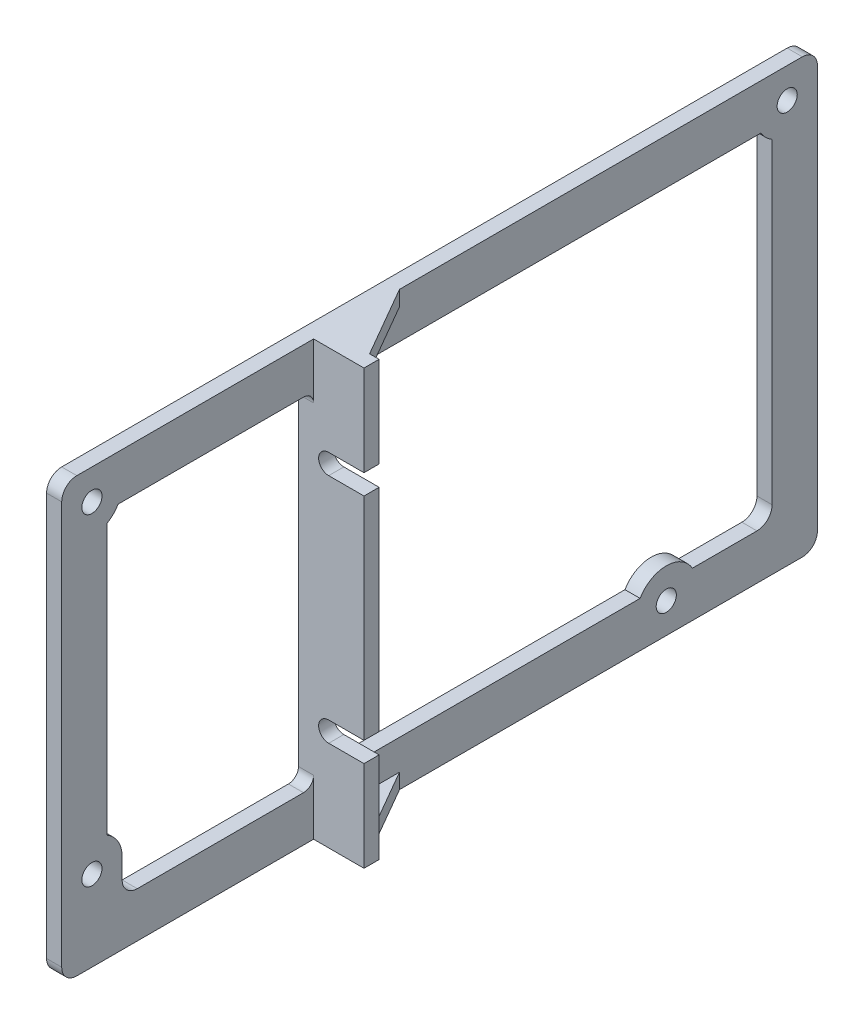
from build123d import *

# Parameters (mm, degrees)
SKETCH_1_R      = 2
EXTRUDE_1_DEPTH = 3
EXTRUDE_2_DEPTH = 3
RIB_6_REACH     = 175.393
SKETCH_4_WALL_W = 365.010042788
SKETCH_4_WALL_H = 3
RIB_7_REACH     = 175.393
SKETCH_5_WALL_W = 365.010042788
SKETCH_5_WALL_H = 3
FILLET_1_R      = 2


with BuildPart() as part:
    # Эскиз1 → Бобышка-Вытянуть1 (new body)
    with BuildSketch(Plane(origin=(0, 0, 0), x_dir=(0, 0, -1), z_dir=(1, 0, 0))):
        with BuildLine():
            Line((0, 3), (0, 83))
            ThreePointArc((0, 83), (0.878679656, 85.121320344), (3, 86))
            Line((3, 86), (147, 86))
            ThreePointArc((147, 86), (149.121320344, 85.121320344), (150, 83))
            Line((150, 83), (150, 3))
            ThreePointArc((150, 3), (149.121320344, 0.878679656), (147, 0))
            Line((147, 0), (3, 0))
            ThreePointArc((3, 0), (0.878679656, 0.878679656), (0, 3))
        make_face()
        with Locations((6, 80)):
            Circle(SKETCH_1_R, mode=Mode.SUBTRACT)
        with Locations((144, 80)):
            Circle(SKETCH_1_R, mode=Mode.SUBTRACT)
        with Locations((120, 6)):
            Circle(SKETCH_1_R, mode=Mode.SUBTRACT)
        with Locations((6, 16)):
            Circle(SKETCH_1_R, mode=Mode.SUBTRACT)
        with BuildLine():
            Line((9, 74.803847577), (9, 21.196152423))
            ThreePointArc((9, 21.196152423), (11.196152423, 19), (12, 16))
            Line((12, 16), (12, 12))
            ThreePointArc((12, 12), (12.878679656, 9.878679656), (15, 9))
            Line((15, 9), (114.803847577, 9))
            ThreePointArc((114.803847577, 9), (120, 12), (125.196152423, 9))
            Line((125.196152423, 9), (138, 9))
            ThreePointArc((138, 9), (140.121320344, 9.878679656), (141, 12))
            Line((141, 12), (141, 74.803847577))
            ThreePointArc((141, 74.803847577), (139.757359313, 75.757359313), (138.803847577, 77))
            Line((138.803847577, 77), (11.196152423, 77))
            ThreePointArc((11.196152423, 77), (10.242640687, 75.757359313), (9, 74.803847577))
        make_face(mode=Mode.SUBTRACT)
    extrude(amount=EXTRUDE_1_DEPTH)

    # Эскиз2 → Бобышка-Вытянуть2 (add)
    with BuildSketch(Plane(origin=(0, 0, -50), x_dir=(-1, 0, 0), z_dir=(0, 0, -1))):
        with BuildLine():
            Line((0, 86), (-13, 86))
            Line((-13, 86), (-13, 68))
            Line((-13, 68), (-6, 68))
            ThreePointArc((-6, 68), (-4, 66), (-6, 64))
            Line((-6, 64), (-13, 64))
            Line((-13, 64), (-13, 22))
            Line((-13, 22), (-6, 22))
            ThreePointArc((-6, 22), (-4, 20), (-6, 18))
            Line((-6, 18), (-13, 18))
            Line((-13, 18), (-13, 0))
            Line((-13, 0), (0, 0))
            Line((0, 0), (0, 86))
        make_face()
    extrude(amount=EXTRUDE_2_DEPTH)

    # Эскиз4 wall → Ребро6 (add, up to next)
    with BuildSketch(Plane(origin=(7.056201664, 86, -60.025547367), x_dir=(-0.499999999996, 0, -0.866025403787), z_dir=(-0.866025403787, 0, 0.499999999996)), mode=Mode.PRIVATE) as rib_6_sk1:
        with Locations((0, 1.5)):
            Rectangle(SKETCH_4_WALL_W, SKETCH_4_WALL_H)
    rib_6_tool1 = extrude(rib_6_sk1.sketch, amount=RIB_6_REACH, mode=Mode.PRIVATE) - part.part
    add(rib_6_tool1.solids().sort_by_distance((7.056201664, 86, -60.025547367))[0])

    # Эскиз5 wall → Ребро7 (add, up to next)
    with BuildSketch(Plane(origin=(7.056201664, 0, -60.025547367), x_dir=(-0.499999999996, 0, -0.866025403787), z_dir=(0.866025403787, 0, -0.499999999996)), mode=Mode.PRIVATE) as rib_7_sk1:
        with Locations((0, 1.5)):
            Rectangle(SKETCH_5_WALL_W, SKETCH_5_WALL_H)
    rib_7_tool1 = extrude(rib_7_sk1.sketch, amount=-RIB_7_REACH, mode=Mode.PRIVATE) - part.part
    add(rib_7_tool1.solids().sort_by_distance((7.056201664, 0, -60.025547367))[0])

    # Скругление1
    fillet_1_edges = [part.edges().sort_by_distance(p)[0] for p in [
        (1.5, 77, -50),
        (1.5, 77, -53),
        (1.5, 9, -50),
        (1.5, 9, -53),
    ]]
    fillet(fillet_1_edges, radius=FILLET_1_R)


solid = part.part
